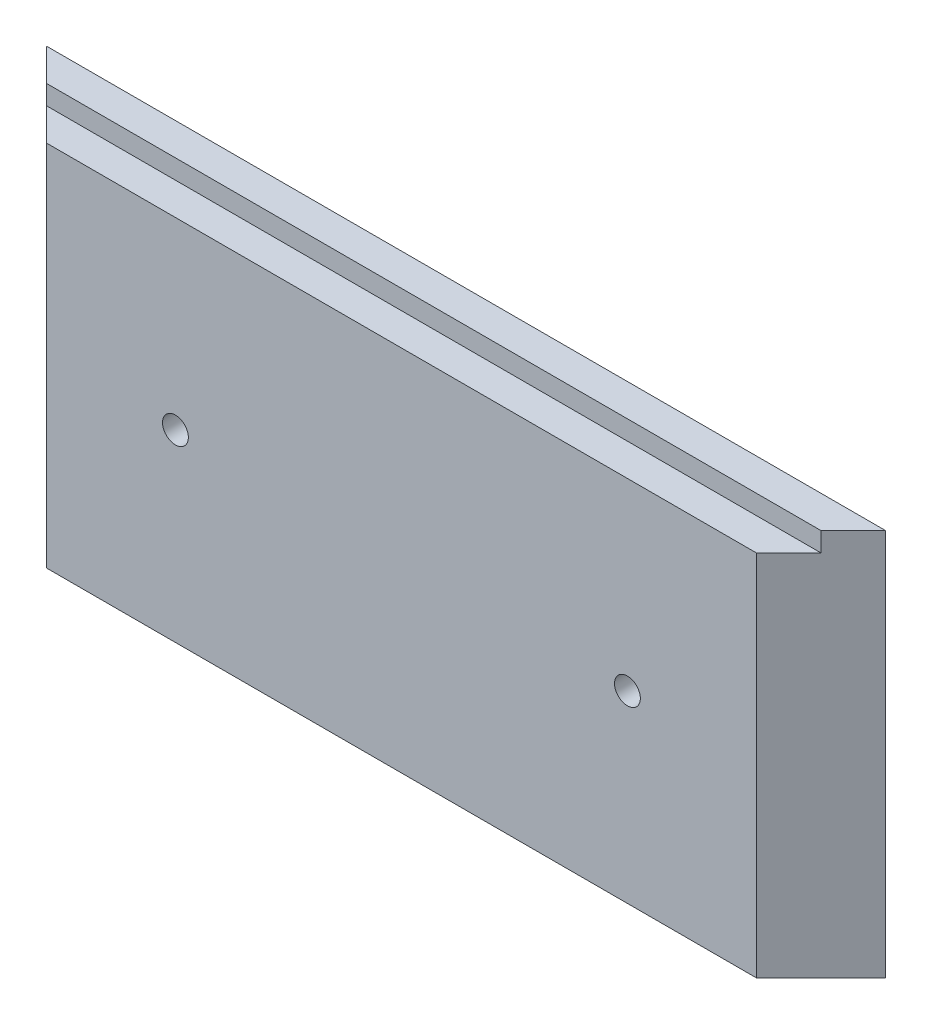
from build123d import *

# Parameters (mm, degrees)
BOSS_EXTRUDE1_DEPTH     = 60
CUT_EXTRUDE1_DEPTH      = 144.527000944
CUT_EXTRUDE1_DEPTH_BACK = 3
SKETCH3_R               = 2
CUT_EXTRUDE2_DEPTH      = 4


with BuildPart() as part:
    # Sketch1 → Boss-Extrude1 (new body)
    with BuildSketch(Plane(origin=(0, 0, 0), x_dir=(1, 0, 0), z_dir=(0, 1, 0))):
        Polygon((130, 10), (0, 10), (10, 0), (120, 0), align=None)
    extrude(amount=BOSS_EXTRUDE1_DEPTH)

    # Sketch2 → Cut-Extrude1 (cut, two sides: drawn at the far end of the back side and taken through both)
    with BuildSketch(Plane(origin=(0, 60, 0), x_dir=(1, 0, 0), z_dir=(0, 1, 0)).offset(-CUT_EXTRUDE1_DEPTH_BACK)):
        Polygon((125, 5), (5, 5), (10, 0), (120, 0), align=None)
    extrude(amount=CUT_EXTRUDE1_DEPTH + CUT_EXTRUDE1_DEPTH_BACK, mode=Mode.SUBTRACT)

    # Sketch3 → Cut-Extrude2 (cut)
    with BuildSketch(Plane.XY):
        with Locations((30, 28.5)):
            Circle(SKETCH3_R)
        with Locations((100, 28.5)):
            Circle(SKETCH3_R)
    extrude(amount=-CUT_EXTRUDE2_DEPTH, mode=Mode.SUBTRACT)


solid = part.part
